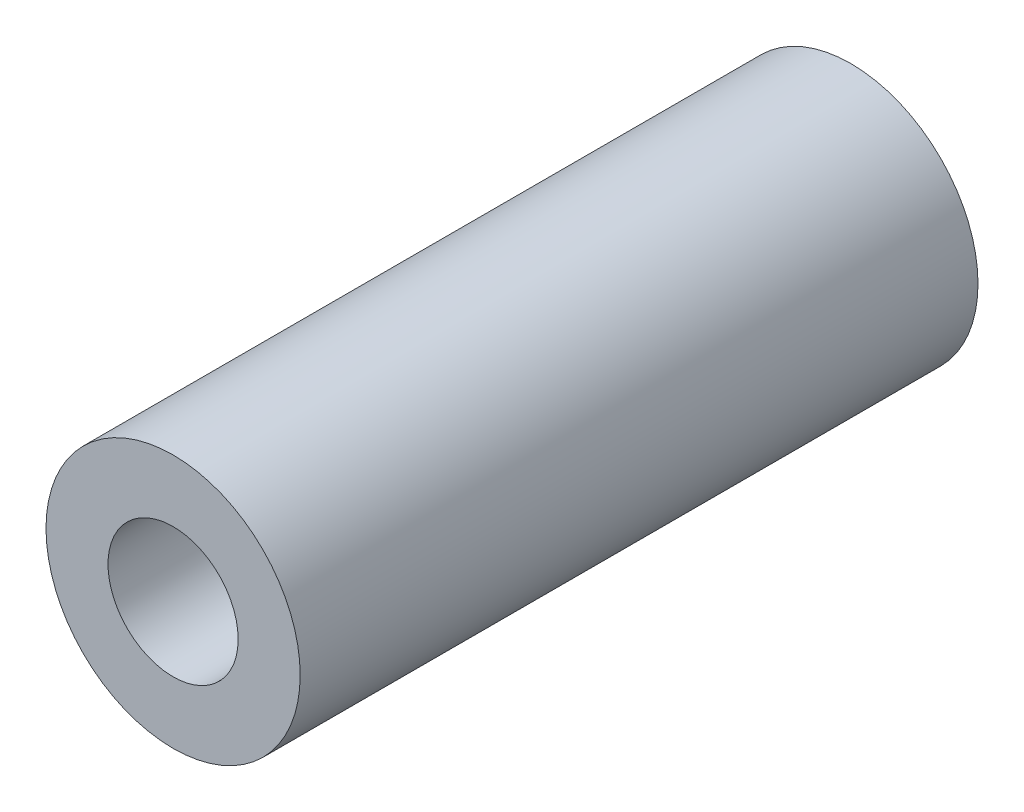
from build123d import *

# Parameters (mm, degrees)
SKETCH1_W = 25.4
SKETCH1_H = 2.3241


with BuildPart() as part:
    # Sketch1 → Revolve1 (revolve)
    with BuildSketch(Plane(origin=(0, 0, 0), x_dir=(0, 0, -1), z_dir=(1, 0, 0)), mode=Mode.PRIVATE) as revolve1_sk:
        with Locations((0, 3.60045)):
            Rectangle(SKETCH1_W, SKETCH1_H)
    revolve(revolve1_sk.sketch.rotate(Axis((0, 0, 43.465184419), (0, 0, -1)), 90), axis=Axis((0, 0, 43.465184419), (0, 0, -1)))


solid = part.part
